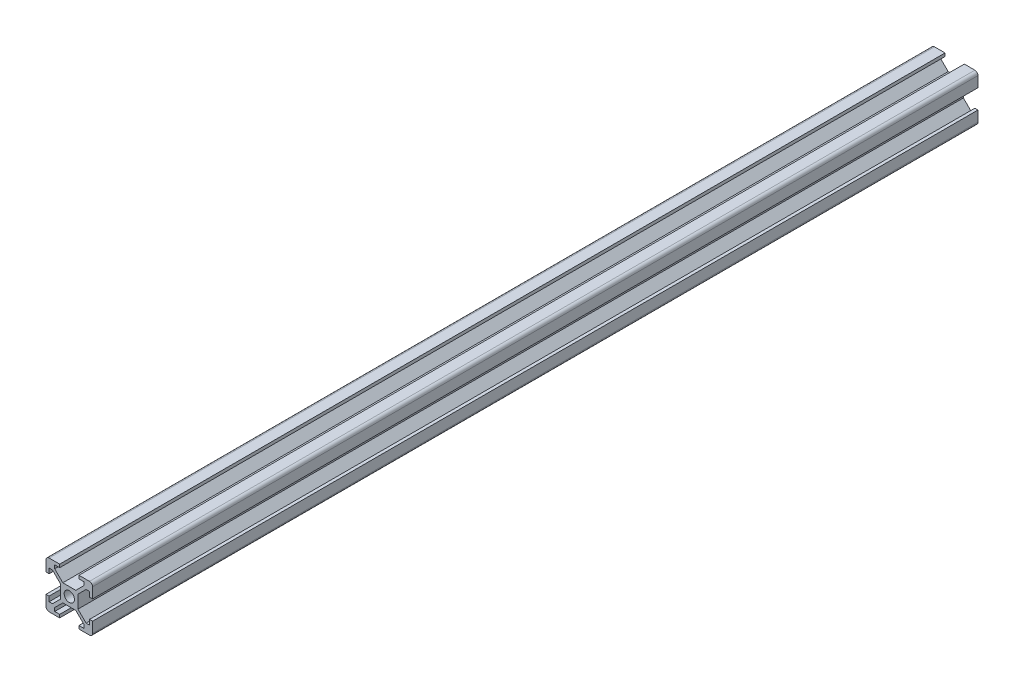
from build123d import *

# Parameters (mm, degrees)
SKETCH_2_R      = 1.65
EXTRUDE_1_DEPTH = 142.5


with BuildPart() as part:
    # 草图2 → 凸台-拉伸1 (new, symmetric)
    with BuildSketch(Plane.XY):
        with BuildLine():
            Line((-2.092893219, -2.8), (-4.7, -5.407106781))
            Line((-4.7, -5.407106781), (-4.7, -6.5))
            Line((-4.7, -6.5), (-3.1, -6.5))
            Line((-3.1, -6.5), (-3.1, -7.5))
            Line((-3.1, -7.5), (-6.5, -7.5))
            ThreePointArc((-6.5, -7.5), (-7.207106781, -7.207106781), (-7.5, -6.5))
            Line((-7.5, -6.5), (-7.5, -3.1))
            Line((-7.5, -3.1), (-6.5, -3.1))
            Line((-6.5, -3.1), (-6.5, -4.7))
            Line((-6.5, -4.7), (-5.407106781, -4.7))
            Line((-5.407106781, -4.7), (-2.8, -2.092893219))
            Line((-2.8, -2.092893219), (-2.8, 2.092893219))
            Line((-2.8, 2.092893219), (-5.407106781, 4.7))
            Line((-5.407106781, 4.7), (-6.5, 4.7))
            Line((-6.5, 4.7), (-6.5, 3.1))
            Line((-6.5, 3.1), (-7.5, 3.1))
            Line((-7.5, 3.1), (-7.5, 6.5))
            ThreePointArc((-7.5, 6.5), (-7.207106781, 7.207106781), (-6.5, 7.5))
            Line((-6.5, 7.5), (-3.1, 7.5))
            Line((-3.1, 7.5), (-3.1, 6.5))
            Line((-3.1, 6.5), (-4.7, 6.5))
            Line((-4.7, 6.5), (-4.7, 5.407106781))
            Line((-4.7, 5.407106781), (-2.092893219, 2.8))
            Line((-2.092893219, 2.8), (2.092893219, 2.8))
            Line((2.092893219, 2.8), (4.7, 5.407106781))
            Line((4.7, 5.407106781), (4.7, 6.5))
            Line((4.7, 6.5), (3.1, 6.5))
            Line((3.1, 6.5), (3.1, 7.5))
            Line((3.1, 7.5), (6.5, 7.5))
            ThreePointArc((6.5, 7.5), (7.207106781, 7.207106781), (7.5, 6.5))
            Line((7.5, 6.5), (7.5, 3.1))
            Line((7.5, 3.1), (6.5, 3.1))
            Line((6.5, 3.1), (6.5, 4.7))
            Line((6.5, 4.7), (5.407106781, 4.7))
            Line((5.407106781, 4.7), (2.8, 2.092893219))
            Line((2.8, 2.092893219), (2.8, -2.092893219))
            Line((2.8, -2.092893219), (5.407106781, -4.7))
            Line((5.407106781, -4.7), (6.5, -4.7))
            Line((6.5, -4.7), (6.5, -3.1))
            Line((6.5, -3.1), (7.5, -3.1))
            Line((7.5, -3.1), (7.5, -6.5))
            ThreePointArc((7.5, -6.5), (7.207106781, -7.207106781), (6.5, -7.5))
            Line((6.5, -7.5), (3.1, -7.5))
            Line((3.1, -7.5), (3.1, -6.5))
            Line((3.1, -6.5), (4.7, -6.5))
            Line((4.7, -6.5), (4.7, -5.407106781))
            Line((4.7, -5.407106781), (2.092893219, -2.8))
            Line((2.092893219, -2.8), (-2.092893219, -2.8))
        make_face()
        Circle(SKETCH_2_R, mode=Mode.SUBTRACT)
    extrude(amount=EXTRUDE_1_DEPTH, both=True)


solid = part.part
